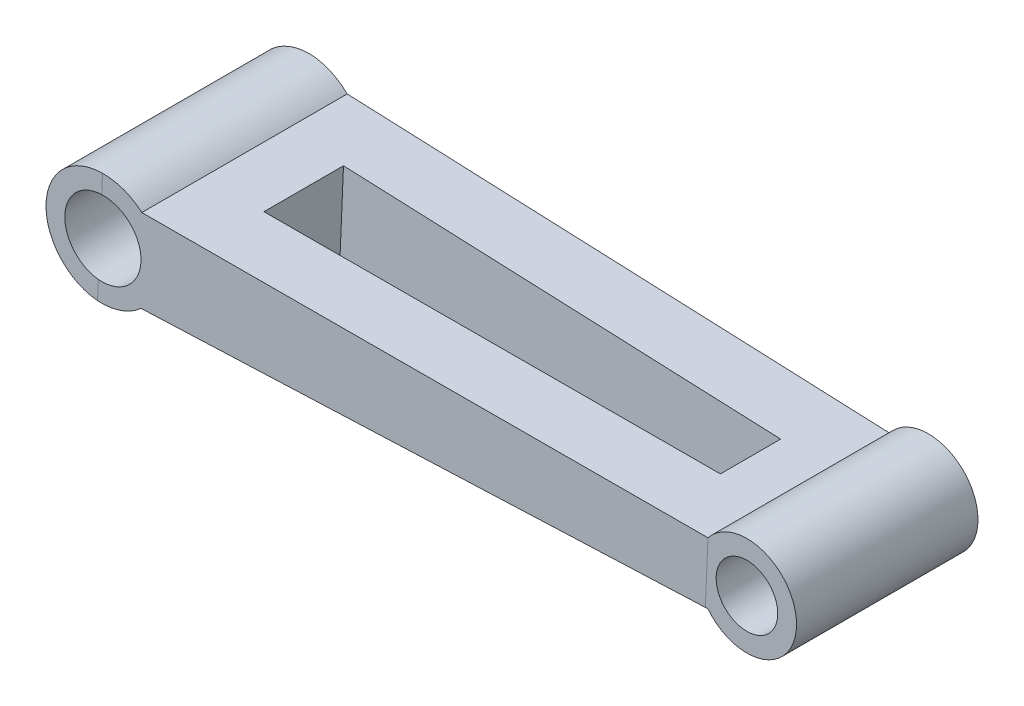
from build123d import *

# Parameters (mm, degrees)
SKETCH1_R               = 22
SKETCH1_R_2             = 18
BOSS_EXTRUDE1_DEPTH     = 121
CUT_EXTRUDE2_DEPTH      = 121
CUT_EXTRUDE2_DEPTH_BACK = 121
CUT_EXTRUDE3_DEPTH      = 121
CUT_EXTRUDE3_DEPTH_BACK = 121


with BuildPart() as part:
    # Sketch1 → Boss-Extrude1 (new body)
    with BuildSketch(Plane.XY):
        with BuildLine():
            ThreePointArc((161.762365998, -18), (213.5, 0), (161.762365998, 18))
            Line((161.762365998, 18), (-162.025328377, 24.163798034))
            ThreePointArc((-162.025328377, 24.163798034), (-217.498436483, 0.321231462), (-162.5, -24.596747752))
            Line((-162.5, -24.596747752), (161.762365998, -18))
        make_face()
        with Locations((-184.5, 0)):
            Circle(SKETCH1_R, mode=Mode.SUBTRACT)
        with Locations((184.5, 0)):
            Circle(SKETCH1_R_2, mode=Mode.SUBTRACT)
    extrude(amount=BOSS_EXTRUDE1_DEPTH)

    # Sketch3 → Cut-Extrude2 (cut, two sides: drawn at the far end of the back side and taken through both)
    with BuildSketch(Plane(origin=(1.081289807, 24.960664454, 0), x_dir=(0.9990630180709081, -0.043279162688854546, 0), z_dir=(0.043279162688854546, 0.9990630180709081, 0)).offset(-CUT_EXTRUDE2_DEPTH_BACK)):
        Polygon((-185.755339203, 0), (160.831772656, -7.5), (275.239090967, -7.5), (275.239090967, 54.458825012), (-286.583387746, 54.458825012), (-286.583387746, 0), align=None)
        Polygon((275.239090967, -113.5), (160.831772656, -113.5), (-185.755339203, -121), (-286.583387746, -121), (-286.583387746, -184.896957676), (275.239090967, -184.896957676), align=None)
    extrude(amount=CUT_EXTRUDE2_DEPTH + CUT_EXTRUDE2_DEPTH_BACK, mode=Mode.SUBTRACT)

    # Sketch4 → Cut-Extrude3 (cut, two sides: drawn at the far end of the back side and taken through both)
    with BuildSketch(Plane(origin=(1.081289807, 24.960664454, 0), x_dir=(0.9990630180709081, -0.043279162688854546, 0), z_dir=(0.043279162688854546, 0.9990630180709081, 0)).offset(-CUT_EXTRUDE3_DEPTH_BACK)):
        Polygon((132.672873166, -42.899081104), (-128.327126834, -37.251150373), (-128.327126834, -83.748849627), (132.672873166, -78.100918896), align=None)
    extrude(amount=CUT_EXTRUDE3_DEPTH + CUT_EXTRUDE3_DEPTH_BACK, mode=Mode.SUBTRACT)


solid = part.part
